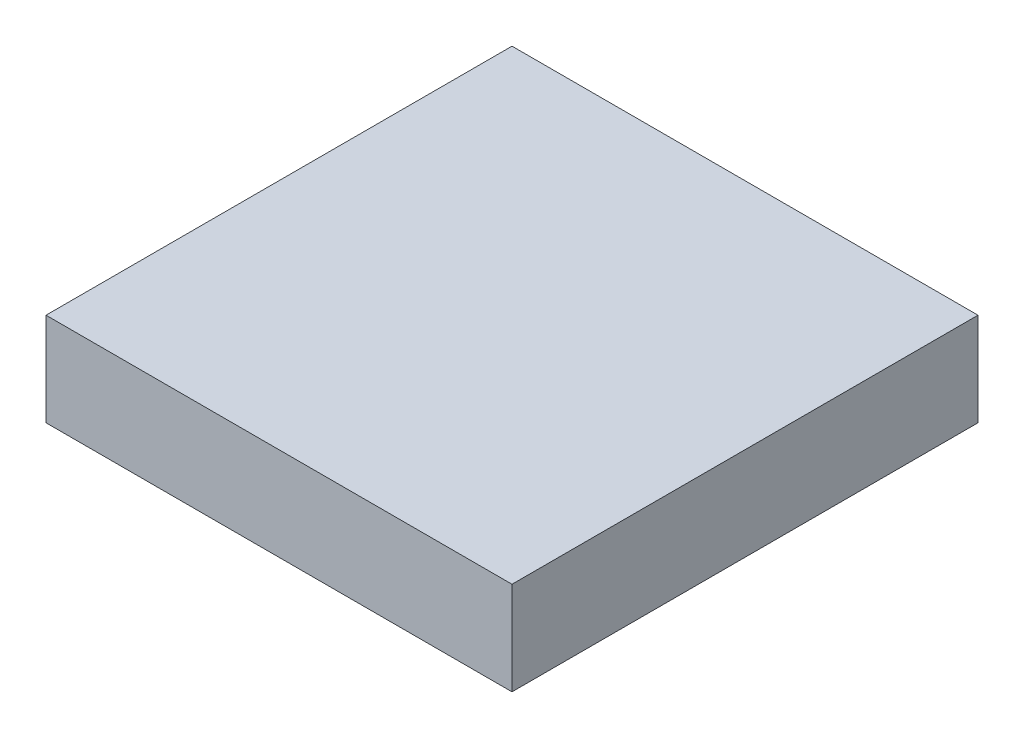
from build123d import *

# Parameters (mm, degrees)
SKETCH1_W           = 16
SKETCH1_H           = 16
BOSS_EXTRUDE1_DEPTH = 3.2


with BuildPart() as part:
    # Sketch1 → Boss-Extrude1 (new body)
    with BuildSketch(Plane(origin=(0, 0, 0), x_dir=(1, 0, 0), z_dir=(0, 1, 0))):
        Rectangle(SKETCH1_W, SKETCH1_H)
    extrude(amount=BOSS_EXTRUDE1_DEPTH)


solid = part.part
